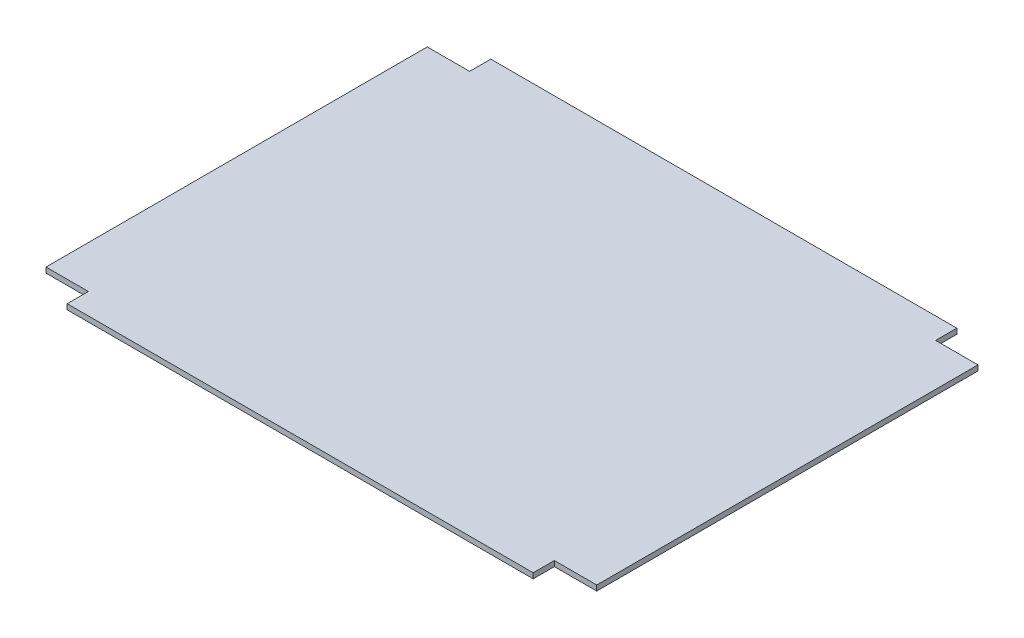
from build123d import *

# Parameters (mm, degrees)
BOSS_EXTRUDE1_DEPTH  = 10
MIRROR2_COPY_1_DEPTH = 10


with BuildPart() as part:
    # Sketch1 → Boss-Extrude1 (new body)
    with BuildSketch(Plane(origin=(0, 0, 0), x_dir=(1, 0, 0), z_dir=(0, 1, 0))):
        Polygon((0, 0), (0, -400), (-440, -400), (-440, -360), (-520, -360), (-520, 0), align=None)
    boss_extrude1 = extrude(amount=BOSS_EXTRUDE1_DEPTH)

    # Mirror1: Boss-Extrude1 across plane
    add(boss_extrude1.mirror(Plane.XY))

    # Mirror2: Boss-Extrude1 across plane
    add(boss_extrude1.mirror(Plane(origin=(0, 0, 0), x_dir=(0, 0, 1), z_dir=(1, 0, 0))))

    # Mirror2 copy 1 sketch → Mirror2 copy 1 (add)
    with BuildSketch(Plane(origin=(0, 0, 0), x_dir=(-1, 0, 0), z_dir=(0, 1, 0))):
        Polygon((0, 0), (0, -400), (-440, -400), (-440, -360), (-520, -360), (-520, 0), align=None)
    extrude(amount=MIRROR2_COPY_1_DEPTH)


solid = part.part
